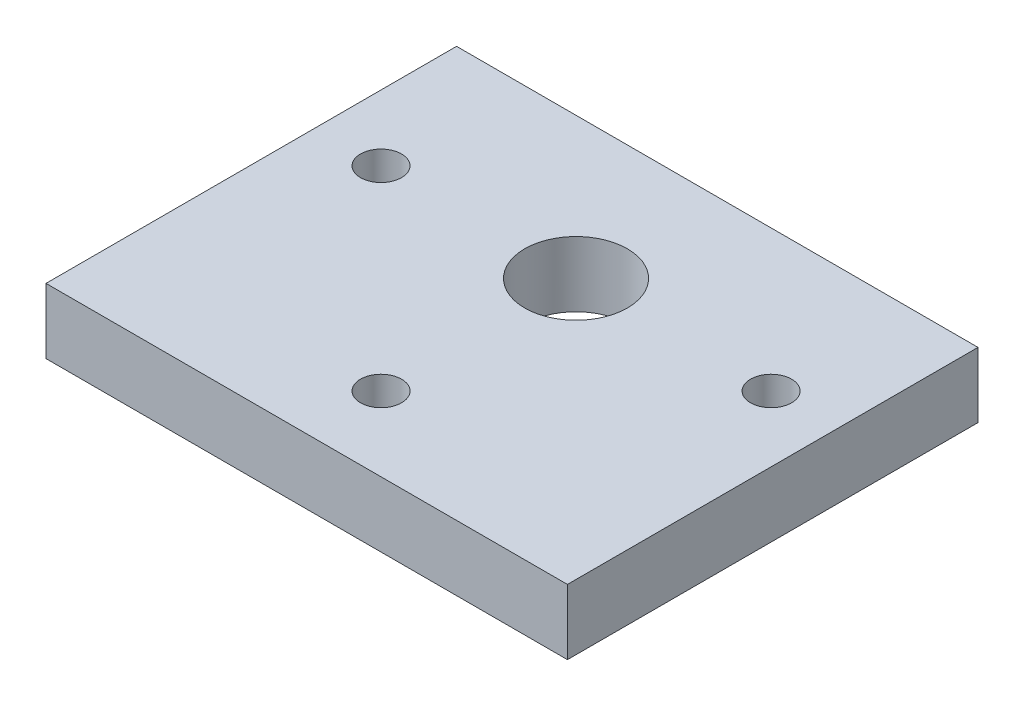
from build123d import *

# Parameters (mm, degrees)
CROQUIS1_W              = 50.8
CROQUIS1_H              = 80
SALIENTE_EXTRUIR1_DEPTH = 6.35
CROQUIS4_R              = 2
CORTAR_EXTRUIR3_DEPTH   = 48.806720239
CROQUIS5_W              = 50.8
CROQUIS5_H              = 12.7
CORTAR_EXTRUIR4_DEPTH   = 48.806720239
CROQUIS6_W              = 50.8
CROQUIS6_H              = 20.526572449
CORTAR_EXTRUIR5_DEPTH   = 10
CROQUIS7_W              = 50.8
CROQUIS7_H              = 6.773427551
CORTAR_EXTRUIR6_DEPTH   = 10
CROQUIS9_R              = 5
CORTAR_EXTRUIR7_DEPTH   = 10


with BuildPart() as part:
    # Croquis1 → Saliente-Extruir1 (new body)
    with BuildSketch(Plane(origin=(0, 0, 0), x_dir=(1, 0, 0), z_dir=(0, 1, 0))):
        Rectangle(CROQUIS1_W, CROQUIS1_H)
    extrude(amount=SALIENTE_EXTRUIR1_DEPTH)

    # Croquis4 → Cortar-Extruir3 (cut, through all)
    with BuildSketch(Plane(origin=(0, 6.35, 0), x_dir=(1, 0, 0), z_dir=(0, 1, 0))):
        with Locations(Location((-19, 19.466091849, 0), (0, 0, 270))):
            Circle(CROQUIS4_R)
        with Locations(Location((19, 19.466091849, 0), (0, 0, 270))):
            Circle(CROQUIS4_R)
        with Locations(Location((0, 0.466091849, 0), (0, 0, 270))):
            Circle(CROQUIS4_R)
    extrude(amount=-CORTAR_EXTRUIR3_DEPTH, mode=Mode.SUBTRACT)

    # Croquis5 → Cortar-Extruir4 (cut, through all)
    with BuildSketch(Plane(origin=(0, 6.35, 0), x_dir=(1, 0, 0), z_dir=(0, 1, 0))):
        with Locations((0, -33.65)):
            Rectangle(CROQUIS5_W, CROQUIS5_H)
    extrude(amount=-CORTAR_EXTRUIR4_DEPTH, mode=Mode.SUBTRACT)

    # Croquis6 → Cortar-Extruir5 (cut)
    with BuildSketch(Plane(origin=(0, 6.35, 0), x_dir=(1, 0, 0), z_dir=(0, 1, 0))):
        with Locations((0, -17.036713776)):
            Rectangle(CROQUIS6_W, CROQUIS6_H)
    extrude(amount=-CORTAR_EXTRUIR5_DEPTH, mode=Mode.SUBTRACT)

    # Croquis7 → Cortar-Extruir6 (cut)
    with BuildSketch(Plane.XZ):
        with Locations((0, -36.613286225)):
            Rectangle(CROQUIS7_W, CROQUIS7_H)
    extrude(amount=-CORTAR_EXTRUIR6_DEPTH, mode=Mode.SUBTRACT)

    # Croquis9 → Cortar-Extruir7 (cut)
    with BuildSketch(Plane.XZ):
        with Locations(Location((0, -19.466091849, 0), (0, 0, 270))):
            Circle(CROQUIS9_R)
    extrude(amount=-CORTAR_EXTRUIR7_DEPTH, mode=Mode.SUBTRACT)


solid = part.part
